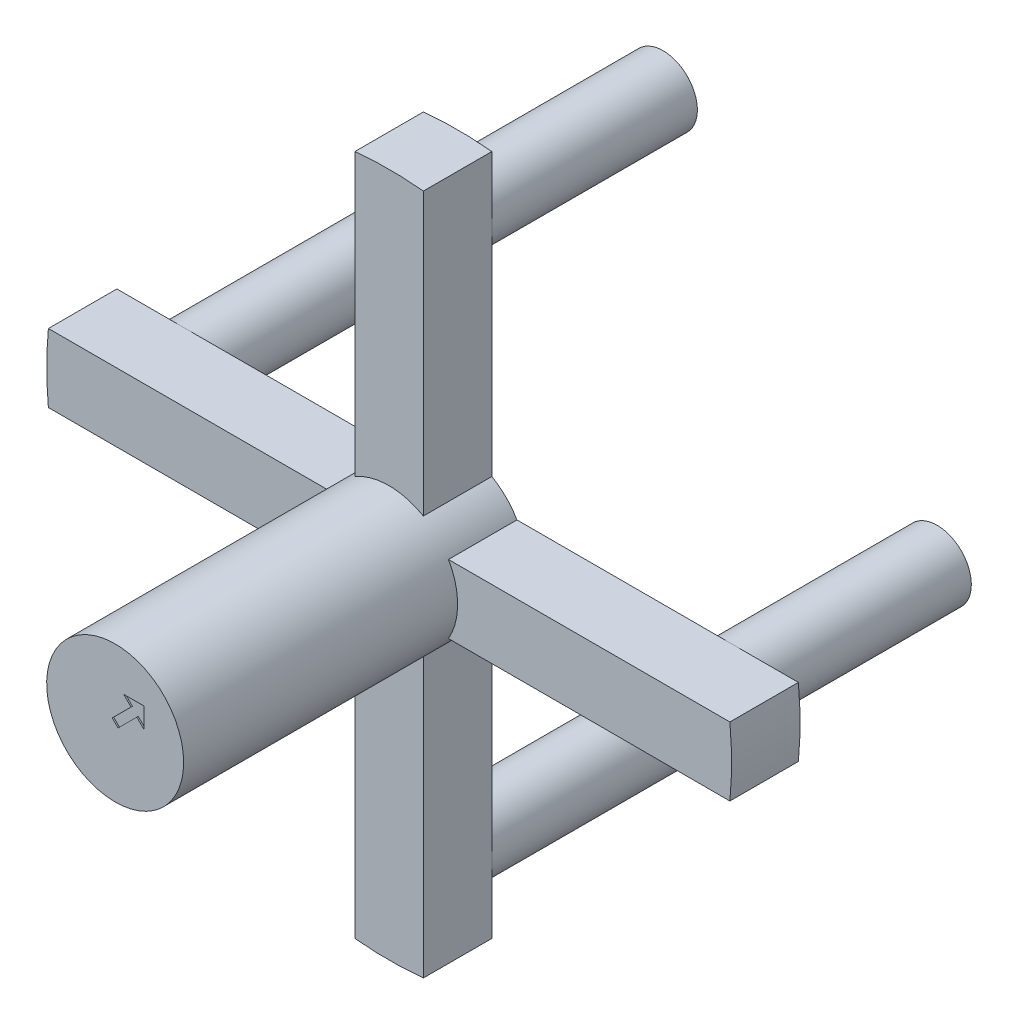
from build123d import *
from build123d.topology import SkipClean

# Parameters (mm, degrees)
SKETCH1_R           = 5
BOSS_EXTRUDE1_DEPTH = 20
BOSS_EXTRUDE3_START = 5
BOSS_EXTRUDE3_DEPTH = 5
SKETCH3_R           = 2.5
BOSS_EXTRUDE4_DEPTH = 15
CUT_EXTRUDE2_DEPTH  = 0.1


with BuildPart() as part:
    # Sketch1 → Boss-Extrude1 (new body)
    with BuildSketch(Plane.XY):
        Circle(SKETCH1_R)
    extrude(amount=BOSS_EXTRUDE1_DEPTH)

    # Sketch2 → Boss-Extrude3 (add)
    with SkipClean():  # the faces are left unmerged after this step: merging them gives an invalid solid
        with BuildSketch(Plane(origin=(0, 0, 0), x_dir=(-1, 0, 0), z_dir=(0, 0, -1)).offset(BOSS_EXTRUDE3_START)):
            with BuildLine():
                ThreePointArc((24.874685928, -2.5), (25, 0), (24.874685928, 2.5))
                Line((24.874685928, 2.5), (4.330127019, 2.5))
                ThreePointArc((4.330127019, 2.5), (3.535533906, 3.535533906), (2.5, 4.330127019))
                Line((2.5, 4.330127019), (2.5, 24.874685928))
                ThreePointArc((2.5, 24.874685928), (0, 25), (-2.5, 24.874685928))
                Line((-2.5, 24.874685928), (-2.5, 4.330127019))
                ThreePointArc((-2.5, 4.330127019), (-3.535533906, 3.535533906), (-4.330127019, 2.5))
                Line((-4.330127019, 2.5), (-24.874685928, 2.5))
                ThreePointArc((-24.874685928, 2.5), (-25, 0), (-24.874685928, -2.5))
                Line((-24.874685928, -2.5), (-4.330127019, -2.5))
                ThreePointArc((-4.330127019, -2.5), (-3.535533906, -3.535533906), (-2.5, -4.330127019))
                Line((-2.5, -4.330127019), (-2.5, -24.874685928))
                ThreePointArc((-2.5, -24.874685928), (0, -25), (2.5, -24.874685928))
                Line((2.5, -24.874685928), (2.5, -4.330127019))
                ThreePointArc((2.5, -4.330127019), (3.535533906, -3.535533906), (4.330127019, -2.5))
                Line((4.330127019, -2.5), (24.874685928, -2.5))
            make_face()
        extrude(amount=-BOSS_EXTRUDE3_DEPTH)

    # Sketch3 → Boss-Extrude4 (add)
    with SkipClean():  # the faces are left unmerged after this step: merging them gives an invalid solid
        with BuildSketch(Plane(origin=(0, 0, -5), x_dir=(-1, 0, 0), z_dir=(0, 0, -1))):
            with Locations(Location((-20, 0, 0), (0, 0, 270))):
                Circle(SKETCH3_R)
            with Locations((0, 20)):
                Circle(SKETCH3_R)
            with Locations(Location((20, 0, 0), (0, 0, 270))):
                Circle(SKETCH3_R)
            with Locations((0, -20)):
                Circle(SKETCH3_R)
        extrude(amount=BOSS_EXTRUDE4_DEPTH)

    # Sketch4 → Cut-Extrude2 (cut)
    with SkipClean():  # the faces are left unmerged after this step: merging them gives an invalid solid
        with BuildSketch(Plane.XY.offset(20)):
            Polygon((0.621320344, 2.121320344), (1.159188309, 1.583452378), (1.697056275, 2.121320344), align=None)
            Polygon((1.159188309, 1.583452378), (1.583452378, 1.159188309), (2.121320344, 1.697056275), (2.121320344, 2.121320344), (1.697056275, 2.121320344), align=None)
            Polygon((2.121320344, 1.697056275), (1.583452378, 1.159188309), (2.121320344, 0.621320344), align=None)
            Polygon((0.212132034, 0.212132034), (0, 0), (0.212132034, -0.212132034), (1.583452378, 1.159188309), (1.159188309, 1.583452378), (0, 0.424264069), align=None)
            Polygon((-0.212132034, 0.212132034), (0, 0), (0.212132034, 0.212132034), (0, 0.424264069), align=None)
        extrude(amount=-CUT_EXTRUDE2_DEPTH, mode=Mode.SUBTRACT)


solid = part.part
